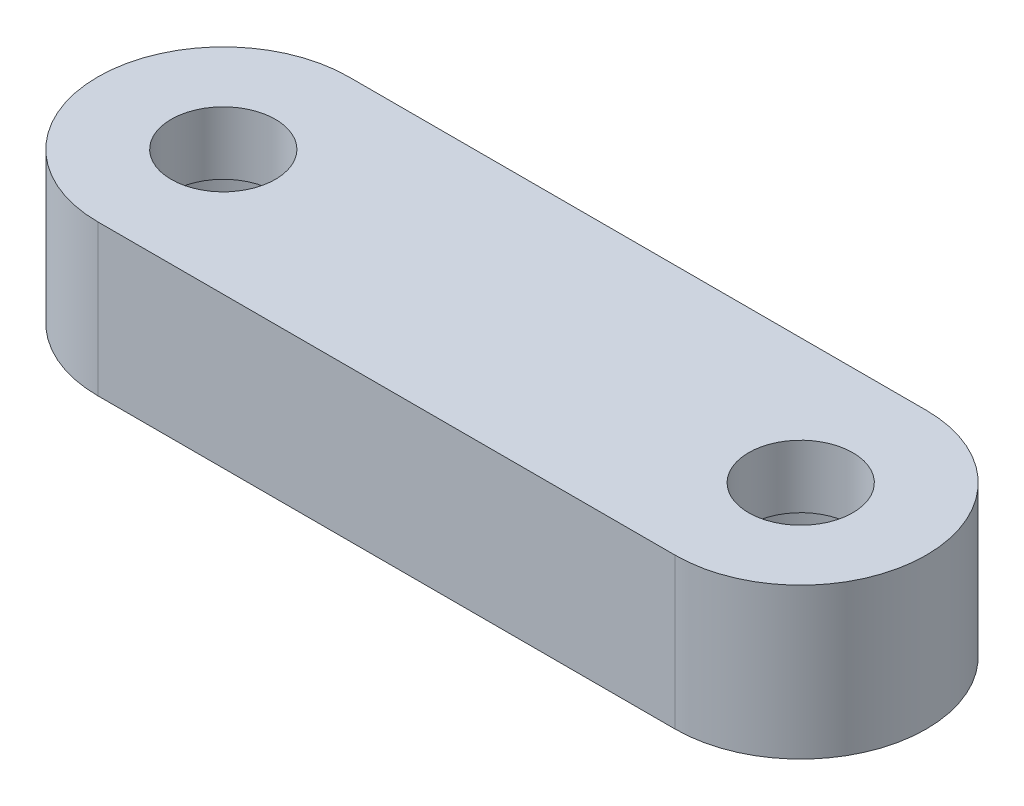
from build123d import *

# Parameters (mm, degrees)
EXTRUDE_1_DEPTH = 6


with BuildPart() as part:
    # 草图1 → 凸台-拉伸1 (new body)
    with BuildSketch(Plane(origin=(0, 0, 0), x_dir=(1, 0, 0), z_dir=(0, 1, 0))):
        with BuildLine():
            Line((0, 5), (23, 5))
            ThreePointArc((23, 5), (28, 0), (23, -5))
            Line((23, -5), (0, -5))
            ThreePointArc((0, -5), (-5, 0), (0, 5))
        make_face()
    extrude(amount=EXTRUDE_1_DEPTH)

    # 草图2 → 切除-旋转1 (revolve, cut)
    with BuildSketch(Plane.XY, mode=Mode.PRIVATE) as cut_revolve_1_sk:
        Polygon((0, 0), (-3.75, 0), (-3.75, 3.5), (-2.075, 3.5), (-2.075, 6), (0, 6), align=None)
    revolve(cut_revolve_1_sk.sketch.rotate(Axis((0, 6, 0), (0, -1, 0)), 270), axis=Axis((0, 6, 0), (0, -1, 0)), mode=Mode.SUBTRACT)

    # 草图3 → 切除-旋转2 (revolve, cut)
    with BuildSketch(Plane.XY, mode=Mode.PRIVATE) as cut_revolve_2_sk:
        Polygon((23, 0), (19.25, 0), (19.25, 3.5), (20.925, 3.5), (20.925, 6), (23, 6), align=None)
    revolve(cut_revolve_2_sk.sketch.rotate(Axis((23, 0, 0), (0, 1, 0)), 270), axis=Axis((23, 0, 0), (0, 1, 0)), mode=Mode.SUBTRACT)


solid = part.part
